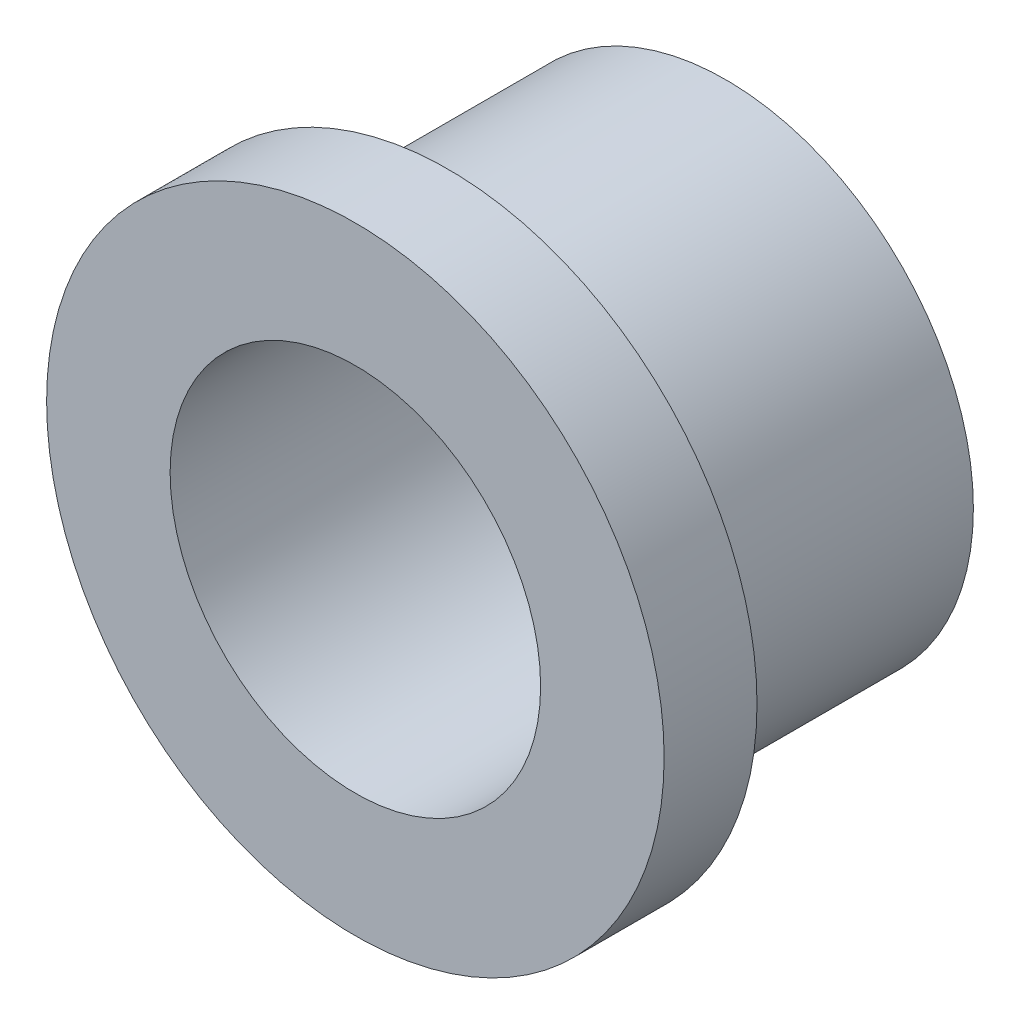
from build123d import *


with BuildPart() as part:
    # Sketch2 → Revolve1 (revolve)
    with BuildSketch(Plane(origin=(0, 0, 0), x_dir=(0, 0, -1), z_dir=(1, 0, 0)), mode=Mode.PRIVATE) as revolve1_sk:
        Polygon((0, 4.7625), (0, 7.9375), (2.3876, 7.9375), (2.3876, 6.3627), (9.525, 6.3627), (9.525, 4.7625), align=None)
    revolve(revolve1_sk.sketch.rotate(Axis((0, 0, 0), (0, 0, -1)), 90), axis=Axis((0, 0, 0), (0, 0, -1)))


solid = part.part
